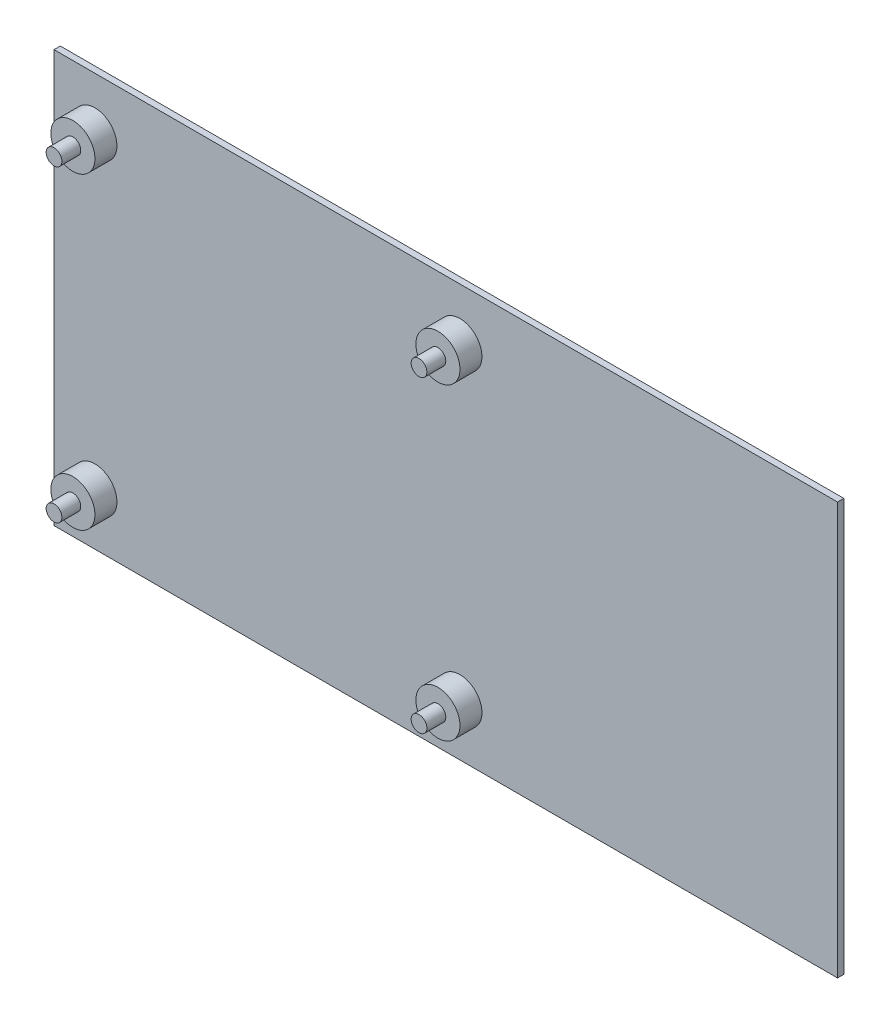
from build123d import *

# Parameters (mm, degrees)
SKETCH1_W           = 124.5
SKETCH1_H           = 65.5
BOSS_EXTRUDE1_DEPTH = 1
SKETCH2_R           = 3.5
BOSS_EXTRUDE2_DEPTH = 3.5
SKETCH3_R           = 1.25
BOSS_EXTRUDE3_DEPTH = 3


with BuildPart() as part:
    # Sketch1 → Boss-Extrude1 (new body)
    with BuildSketch(Plane.XY):
        Rectangle(SKETCH1_W, SKETCH1_H)
    extrude(amount=BOSS_EXTRUDE1_DEPTH)

    # Sketch2 → Boss-Extrude2 (add)
    with BuildSketch(Plane.XY.offset(1)):
        with Locations(Location((-55.75, 24.5, 0), (0, 0, 180))):
            Circle(SKETCH2_R)
        with Locations(Location((2.25, 24.5, 0), (0, 0, 180))):
            Circle(SKETCH2_R)
        with Locations(Location((2.25, -24.5, 0), (0, 0, 180))):
            Circle(SKETCH2_R)
        with Locations(Location((-55.75, -24.5, 0), (0, 0, 180))):
            Circle(SKETCH2_R)
    extrude(amount=BOSS_EXTRUDE2_DEPTH)

    # Sketch3 → Boss-Extrude3 (add)
    with BuildSketch(Plane.XY.offset(4.5)):
        with Locations((-55.75, 24.5)):
            Circle(SKETCH3_R)
        with Locations((2.25, 24.5)):
            Circle(SKETCH3_R)
        with Locations((2.25, -24.5)):
            Circle(SKETCH3_R)
        with Locations((-55.75, -24.5)):
            Circle(SKETCH3_R)
    extrude(amount=BOSS_EXTRUDE3_DEPTH)


solid = part.part
